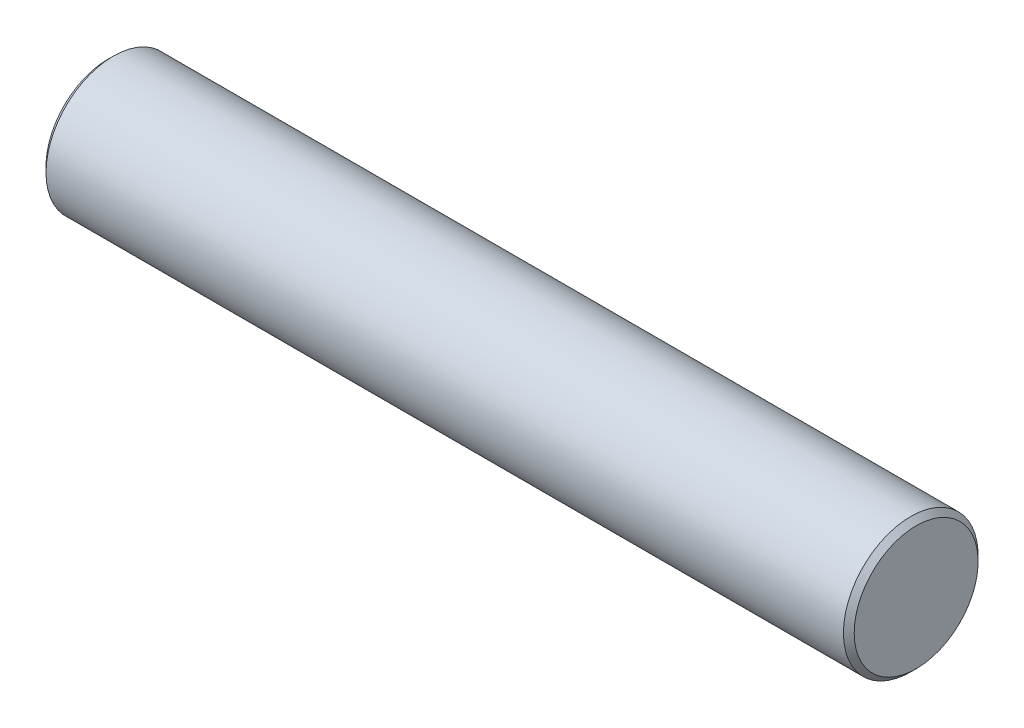
from build123d import *

# Parameters (mm, degrees)
SKETCH1_W     = 30
SKETCH1_H     = 2.5
CHAMFER1_SIZE = 0.2


with BuildPart() as part:
    # Sketch1 → Revolve1 (revolve)
    with BuildSketch(Plane.XY, mode=Mode.PRIVATE) as revolve1_sk:
        with Locations((15, 1.25)):
            Rectangle(SKETCH1_W, SKETCH1_H)
    revolve(revolve1_sk.sketch.rotate(Axis((0, 0, 0), (1, 0, 0)), 90), axis=Axis((0, 0, 0), (1, 0, 0)))

    # Chamfer1
    chamfer1_edges = [part.edges().sort_by_distance(p)[0] for p in [
        (30, 0, -2.5),
        (0, 0, -2.5),
    ]]
    chamfer(chamfer1_edges, length=CHAMFER1_SIZE)


solid = part.part
